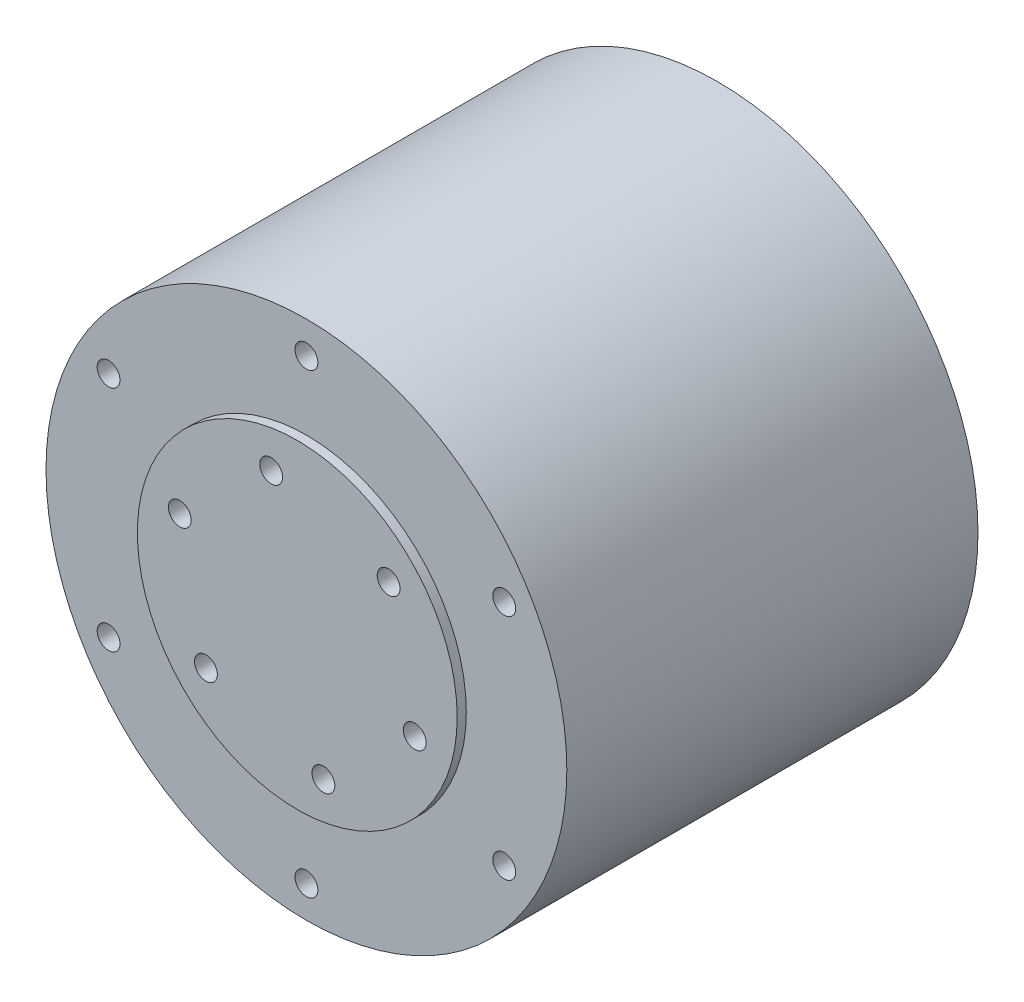
from build123d import *

# Parameters (mm, degrees)
SKETCH_1_R      = 28.5
EXTRUDE_1_DEPTH = 45
SKETCH_2_R      = 17.5
EXTRUDE_2_DEPTH = 1
M3X0_5_1_D      = 2.5
M3X0_5_1_DEPTH  = 4.248924226
M3X0_5_1_TIP    = 0.751075774
M3X0_5_2_D      = 2.5
M3X0_5_2_DEPTH  = 4.248924226
M3X0_5_2_TIP    = 0.751075774
M3X0_5_3_D      = 2.5
M3X0_5_3_DEPTH  = 4.248924226
M3X0_5_3_TIP    = 0.751075774


with BuildPart() as part:
    # 草图1 → 凸台-拉伸1 (new body)
    with BuildSketch(Plane.XY):
        with Locations(Location((0, 0, 0), (0, 0, 180))):
            Circle(SKETCH_1_R)
    extrude(amount=EXTRUDE_1_DEPTH)

    # 草图2 → 凸台-拉伸2 (add)
    with BuildSketch(Plane.XY.offset(45)):
        Circle(SKETCH_2_R)
    extrude(amount=EXTRUDE_2_DEPTH)

    # M3x0.5 螺纹孔1
    with Locations(Plane(origin=(0, 25, 45), x_dir=(1, 0, 0), z_dir=(0, 0, 1))):
        with Locations((0, 0), (21.650635095, -12.5), (21.650635095, -37.5), (0, -50), (-21.650635095, -37.5), (-21.650635095, -12.5)):
            Hole(M3X0_5_1_D / 2, depth=M3X0_5_1_DEPTH)
            with Locations((0, 0, -(M3X0_5_1_DEPTH + M3X0_5_1_TIP / 2))):  # 118° drill point
                Cone(0, M3X0_5_1_D / 2, M3X0_5_1_TIP, mode=Mode.SUBTRACT)

    # M3x0.5 螺纹孔2
    with Locations(Plane(origin=(-2.857682397, 13.194076372, 46), x_dir=(1, 0, 0), z_dir=(0, 0, 1))):
        with Locations((0, 0), (12.855246516, -4.122212634), (15.712928913, -17.316289006), (5.715364794, -26.388152744), (-7.139881722, -22.26594011), (-9.997564119, -9.071863738)):
            Hole(M3X0_5_2_D / 2, depth=M3X0_5_2_DEPTH)
            with Locations((0, 0, -(M3X0_5_2_DEPTH + M3X0_5_2_TIP / 2))):  # 118° drill point
                Cone(0, M3X0_5_2_D / 2, M3X0_5_2_TIP, mode=Mode.SUBTRACT)

    # M3x0.5 螺纹孔3
    with Locations(Plane(origin=(13.435028843, 13.435028843, 0), x_dir=(-1, 0, 0), z_dir=(0, 0, -1))):
        with Locations((0, 0), (0, -26.870057686), (26.870057686, -26.870057686), (26.870057686, 0)):
            Hole(M3X0_5_3_D / 2, depth=M3X0_5_3_DEPTH)
            with Locations((0, 0, -(M3X0_5_3_DEPTH + M3X0_5_3_TIP / 2))):  # 118° drill point
                Cone(0, M3X0_5_3_D / 2, M3X0_5_3_TIP, mode=Mode.SUBTRACT)


solid = part.part
